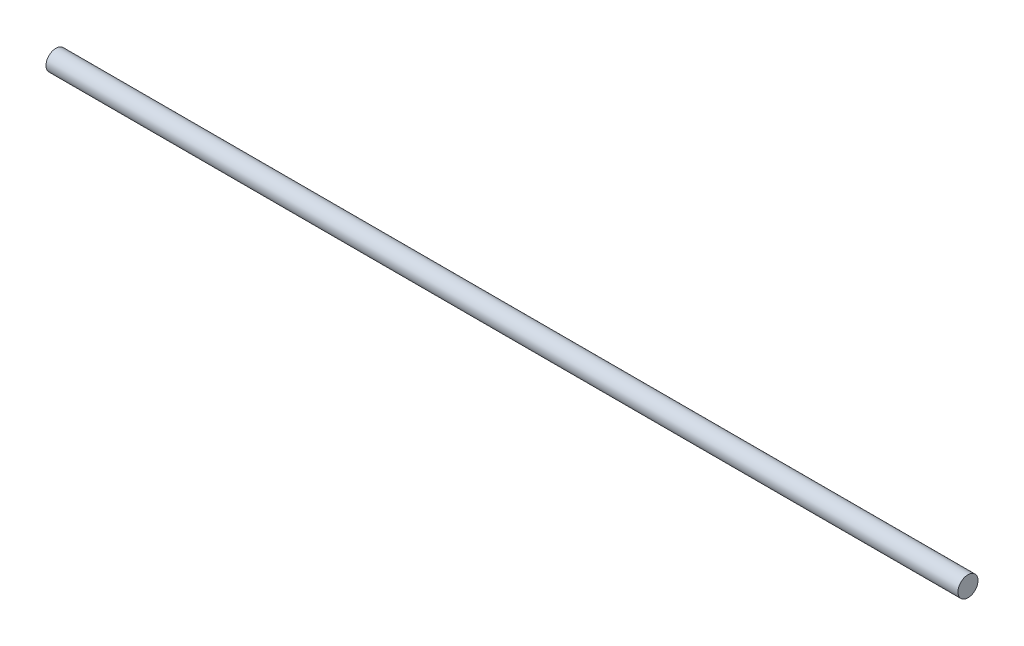
from build123d import *

# Parameters (mm, degrees)
SKETCH2_R           = 3.175
BOSS_EXTRUDE1_DEPTH = 288.925


with BuildPart() as part:
    # Sketch2 → Boss-Extrude1 (new body)
    with BuildSketch(Plane(origin=(0, 0, 0), x_dir=(0, 0, -1), z_dir=(1, 0, 0))):
        Circle(SKETCH2_R)
    extrude(amount=BOSS_EXTRUDE1_DEPTH)


solid = part.part
